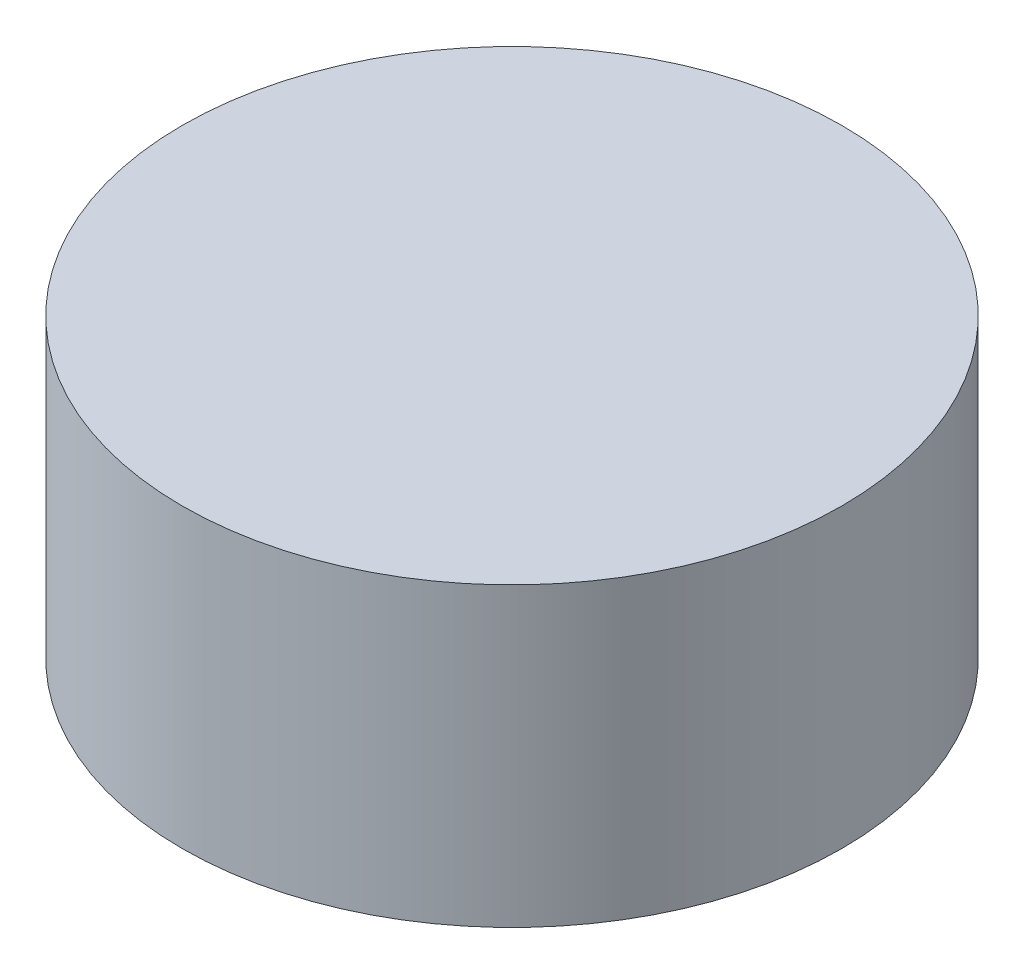
from build123d import *

# Parameters (mm, degrees)
SKETCH1_R           = 3
BOSS_EXTRUDE1_DEPTH = 2.7


with BuildPart() as part:
    # Sketch1 → Boss-Extrude1 (new body)
    with BuildSketch(Plane(origin=(0, 0, 0), x_dir=(1, 0, 0), z_dir=(0, 1, 0))):
        with Locations(Location((0, 0, 0), (0, 0, 90))):
            Circle(SKETCH1_R)
    extrude(amount=BOSS_EXTRUDE1_DEPTH)


solid = part.part
